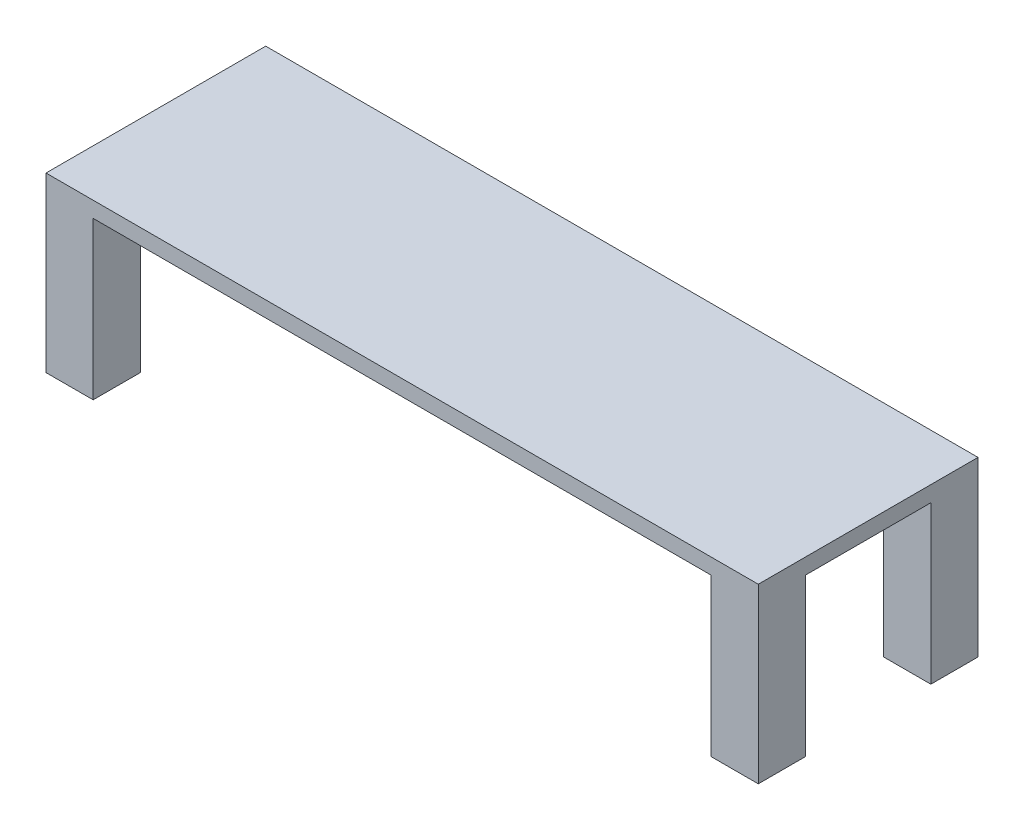
from build123d import *

# Parameters (mm, degrees)
ESQUISSE1_R          = 2
BOSS_EXTRU_1_DEPTH   = 50
BOSS_EXTRU_1_2_DEPTH = 50
BOSS_EXTRU_1_3_DEPTH = 50
BOSS_EXTRU_1_4_DEPTH = 50
ESQUISSE2_W          = 226.6
ESQUISSE2_H          = 69.9
BOSS_EXTRU_2_DEPTH   = 5


with BuildPart() as part:
    # Esquisse1 → Boss.-Extru.1 (new body)
    with BuildSketch(Plane(origin=(0, 0, 0), x_dir=(1, 0, 0), z_dir=(0, 1, 0))):
        Polygon((-113.3, -27.45), (-113.3, -19.95), (-98.3, -19.95), (-98.3, -34.95), (-113.3, -34.95), align=None)
        with Locations(Location((-105.8, -27.45, 0), (0, 0, 270))):
            Circle(ESQUISSE1_R, mode=Mode.SUBTRACT)
    extrude(amount=BOSS_EXTRU_1_DEPTH)



with BuildPart() as body_2:
    # Esquisse1 → Boss.-Extru.1 2 (new body)
    with BuildSketch(Plane(origin=(0, 0, 0), x_dir=(1, 0, 0), z_dir=(0, 1, 0))):
        Polygon((-113.3, -74.85), (-113.3, -82.35), (-113.3, -89.85), (-98.3, -89.85), (-98.3, -74.85), align=None)
        with Locations(Location((-105.8, -82.35, 0), (0, 0, 90))):
            Circle(ESQUISSE1_R, mode=Mode.SUBTRACT)
    extrude(amount=BOSS_EXTRU_1_2_DEPTH)


with BuildPart() as body_3:
    # Esquisse1 → Boss.-Extru.1 3 (new body)
    with BuildSketch(Plane(origin=(0, 0, 0), x_dir=(1, 0, 0), z_dir=(0, 1, 0))):
        Polygon((98.3, -74.85), (113.3, -74.85), (113.3, -82.35), (113.3, -89.85), (98.3, -89.85), align=None)
        with Locations(Location((105.8, -82.35, 0), (0, 0, 270))):
            Circle(ESQUISSE1_R, mode=Mode.SUBTRACT)
    extrude(amount=BOSS_EXTRU_1_3_DEPTH)


with BuildPart() as body_4:
    # Esquisse1 → Boss.-Extru.1 4 (new body)
    with BuildSketch(Plane(origin=(0, 0, 0), x_dir=(1, 0, 0), z_dir=(0, 1, 0))):
        Polygon((113.3, -34.95), (113.3, -27.45), (113.3, -19.95), (98.3, -19.95), (98.3, -34.95), align=None)
        with Locations(Location((105.8, -27.45, 0), (0, 0, 90))):
            Circle(ESQUISSE1_R, mode=Mode.SUBTRACT)
    extrude(amount=BOSS_EXTRU_1_4_DEPTH)


with BuildPart() as part_1:
    add(part.part)

    add(body_2.part)  # Boss.-Extru.2 merges body 2

    add(body_3.part)  # Boss.-Extru.2 merges body 3

    add(body_4.part)  # Boss.-Extru.2 merges body 4
    # Esquisse2 → Boss.-Extru.2 (add)
    with BuildSketch(Plane(origin=(0, 50, 0), x_dir=(1, 0, 0), z_dir=(0, 1, 0))):
        with Locations((0, -54.9)):
            Rectangle(ESQUISSE2_W, ESQUISSE2_H)
    extrude(amount=BOSS_EXTRU_2_DEPTH)


solid = part_1.part
